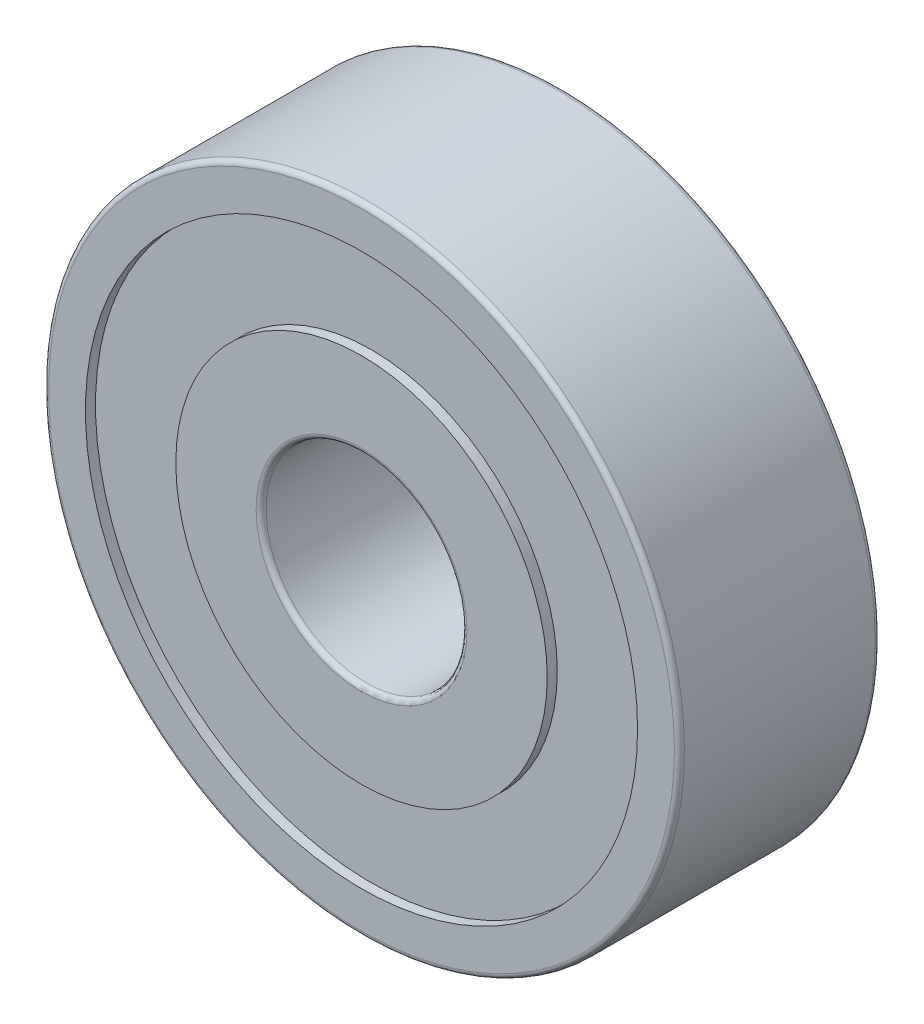
from build123d import *

# Parameters (mm, degrees)
SKETCH1_R           = 9.5
SKETCH1_R_2         = 3
BOSS_EXTRUDE1_DEPTH = 6
SKETCH2_R           = 8.25
SKETCH2_R_2         = 5.55
CUT_EXTRUDE1_DEPTH  = 0.3
CUT_EXTRUDE2_START  = -5.5
SKETCH2_2_R         = 8.25
SKETCH2_2_R_2       = 5.55
CUT_EXTRUDE2_DEPTH  = 0.5
FILLET1_R           = 0.15


with BuildPart() as part:
    # Sketch1 → Boss-Extrude1 (new body)
    with BuildSketch(Plane.XY):
        Circle(SKETCH1_R)
        Circle(SKETCH1_R_2, mode=Mode.SUBTRACT)
    extrude(amount=BOSS_EXTRUDE1_DEPTH)

    # Sketch2 → Cut-Extrude1 (cut)
    with BuildSketch(Plane.XY.offset(6)):
        Circle(SKETCH2_R)
        Circle(SKETCH2_R_2, mode=Mode.SUBTRACT)
    extrude(amount=-CUT_EXTRUDE1_DEPTH, mode=Mode.SUBTRACT)

    # Sketch2<2> → Cut-Extrude2 (cut)
    with BuildSketch(Plane.XY.offset(6).offset(CUT_EXTRUDE2_START)):
        Circle(SKETCH2_2_R)
        Circle(SKETCH2_2_R_2, mode=Mode.SUBTRACT)
    extrude(amount=-CUT_EXTRUDE2_DEPTH, mode=Mode.SUBTRACT)

    # Fillet1
    fillet1_edges = [part.edges().sort_by_distance(p)[0] for p in [
        (-9.5, 0, 0),
        (-9.5, 0, 6),
        (-3, 0, 0),
        (-3, 0, 6),
    ]]
    fillet(fillet1_edges, radius=FILLET1_R)


solid = part.part
